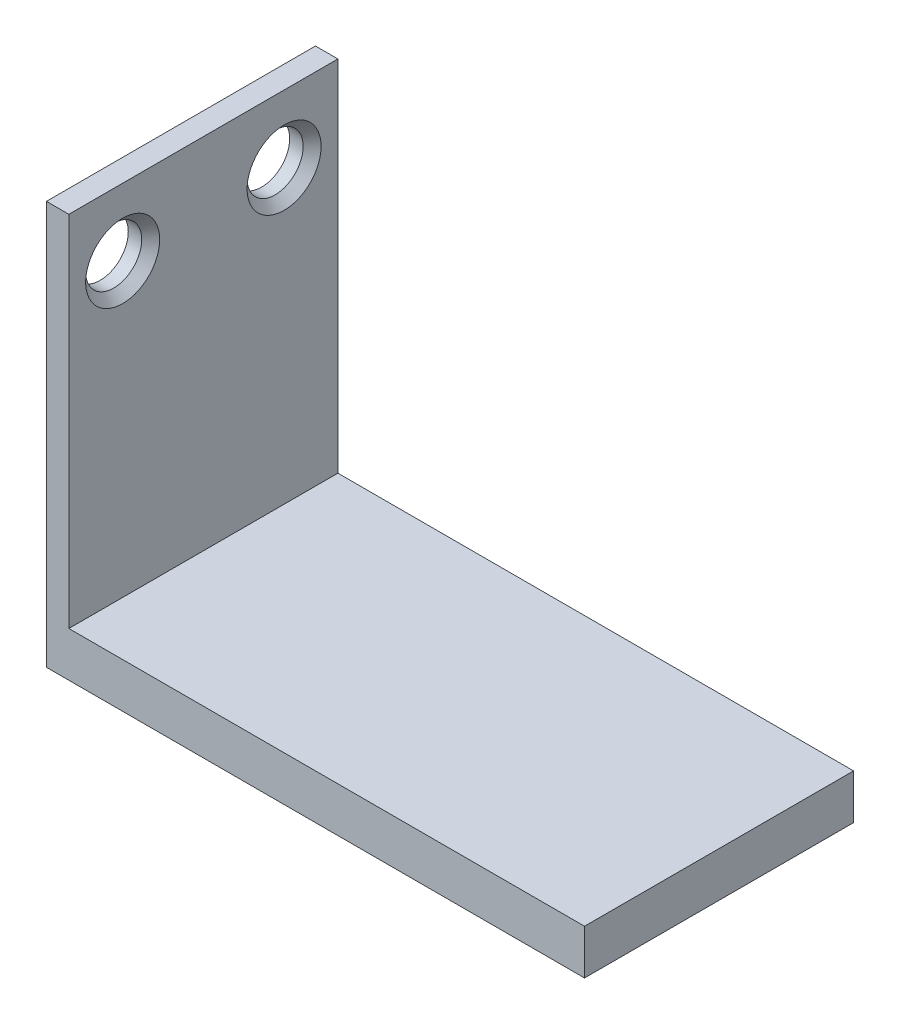
from build123d import *

# Parameters (mm, degrees)
SKETCH_1_W                    = 12
SKETCH_1_H                    = 6
EXTRUDE_1_DEPTH               = 1
SKETCH_2_W                    = 0.5
SKETCH_2_H                    = 6
EXTRUDE_2_DEPTH               = 8
HOLE_WIZARD_M1_6_1_AT_2_COUNT = 2
HOLE_WIZARD_M1_6_1_AT_2_PITCH = 3.6


with BuildPart() as part:
    # 草图1 → 凸台-拉伸1 (new body)
    with BuildSketch(Plane(origin=(0, 0, 0), x_dir=(1, 0, 0), z_dir=(0, 1, 0))):
        Rectangle(SKETCH_1_W, SKETCH_1_H)
    extrude(amount=EXTRUDE_1_DEPTH)

    # 草图2 → 凸台-拉伸2 (add)
    with BuildSketch(Plane(origin=(0, 1, 0), x_dir=(1, 0, 0), z_dir=(0, 1, 0))):
        with Locations((-5.75, 0)):
            Rectangle(SKETCH_2_W, SKETCH_2_H)
    extrude(amount=EXTRUDE_2_DEPTH)

    # 草图5 → M1.6 螺纹孔1 (revolve, cut)
    with BuildSketch(Plane(origin=(-5.5, 7.5, -1.8), x_dir=(0, 0, -1), z_dir=(0, 1, 0))):
        Polygon((0, 0), (0, 0.5), (0.625, 0.5), (0.625, 0.2), (0.825, 0), align=None)
    hole_wizard_m1_6_1 = revolve(axis=Axis((0.85, 7.5, -1.8), (-1, 0, 0)), mode=Mode.SUBTRACT)

    # M1.6 螺纹孔1 at 2: M1.6 螺纹孔1 ×2
    with Locations(*[(0, 0, i * HOLE_WIZARD_M1_6_1_AT_2_PITCH) for i in range(1, HOLE_WIZARD_M1_6_1_AT_2_COUNT)]):
        add(hole_wizard_m1_6_1, mode=Mode.SUBTRACT)


solid = part.part
